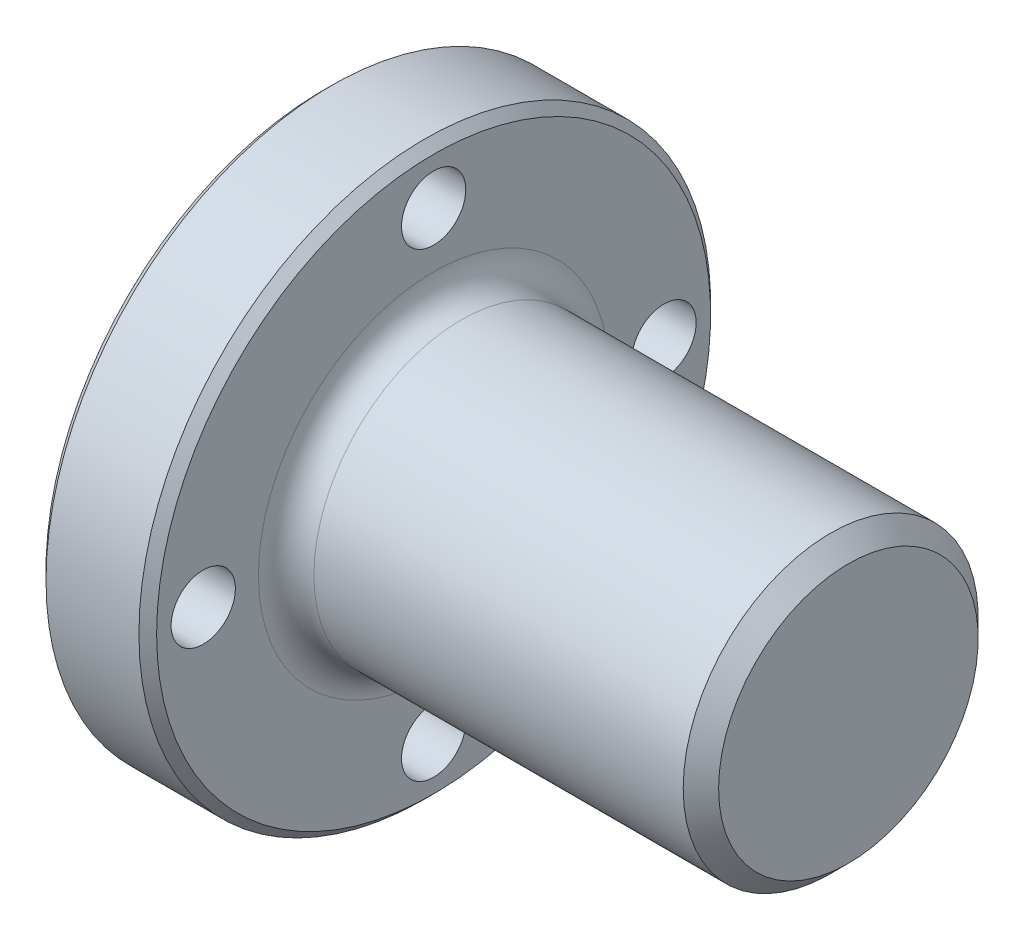
from build123d import *

# Parameters (mm, degrees)
FILLET1_R          = 2.3876
CHAMFER1_SIZE      = 0.762
CHAMFER2_SIZE      = 1.524
CUT_EXTRUDE2_START = 14.351
SKETCH2_R          = 2.7686
CUT_EXTRUDE2_DEPTH = 76.325619122
CUT_EXTRUDE4_START = 14.351
SKETCH3_R          = 2.7686
CUT_EXTRUDE4_DEPTH = 76.325619122


with BuildPart() as part:
    # Sketch1 → Revolve1 (revolve)
    with BuildSketch(Plane(origin=(0, 0, 0), x_dir=(0, 1, 0), z_dir=(0, 0, 1)), mode=Mode.PRIVATE) as revolve1_sk:
        Polygon((0, 0), (8.7122, 0), (8.7122, -4.826), (24.6126, -4.826), (24.6126, -14.351), (12.7, -14.351), (12.7, -50.0634), (0, -50.0634), align=None)
    revolve(revolve1_sk.sketch.rotate(Axis((-25.4, 0, 0), (1, 0, 0)), 90), axis=Axis((-25.4, 0, 0), (1, 0, 0)))

    # Fillet1
    fillet1_edges = [part.edges().sort_by_distance(p)[0] for p in [
        (14.351, 0, -12.7),
    ]]
    fillet(fillet1_edges, radius=FILLET1_R)

    # Chamfer1
    chamfer1_edges = [part.edges().sort_by_distance(p)[0] for p in [
        (14.351, 0, -24.6126),
        (4.826, 0, -24.6126),
        (0, 0, -8.7122),
    ]]
    chamfer(chamfer1_edges, length=CHAMFER1_SIZE)

    # Chamfer2
    chamfer2_edges = [part.edges().sort_by_distance(p)[0] for p in [
        (50.0634, 0, -12.7),
    ]]
    chamfer(chamfer2_edges, length=CHAMFER2_SIZE)

    # Sketch2 → Cut-Extrude2 (cut, through all)
    with BuildSketch(Plane.YZ.offset(CUT_EXTRUDE2_START)):
        with Locations(Location((19.8374, 0, 0), (0, 0, 270))):
            Circle(SKETCH2_R)
    extrude(amount=-CUT_EXTRUDE2_DEPTH, mode=Mode.SUBTRACT)

    # Sketch3 → Cut-Extrude4 (cut, through all)
    with BuildSketch(Plane.YZ.offset(CUT_EXTRUDE4_START)):
        with Locations(Location((0, 19.8374, 0), (0, 0, 270))):
            Circle(SKETCH3_R)
        with Locations(Location((-19.8374, 0, 0), (0, 0, 270))):
            Circle(SKETCH3_R)
        with Locations(Location((0, -19.8374, 0), (0, 0, 270))):
            Circle(SKETCH3_R)
    extrude(amount=-CUT_EXTRUDE4_DEPTH, mode=Mode.SUBTRACT)


solid = part.part
